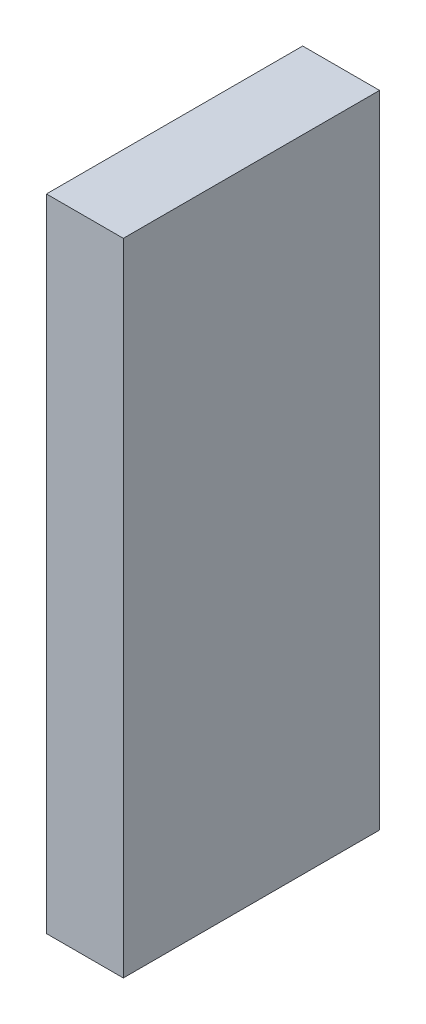
from build123d import *

# Parameters (mm, degrees)
SKETCH1_W           = 12
SKETCH1_H           = 40
BOSS_EXTRUDE1_DEPTH = 50
F_25_SCALE_SCALE    = 0.25


with BuildPart() as part:
    # Sketch1 → Boss-Extrude1 (new, symmetric)
    with BuildSketch(Plane(origin=(0, 0, 0), x_dir=(1, 0, 0), z_dir=(0, 1, 0))):
        Rectangle(SKETCH1_W, SKETCH1_H)
    extrude(amount=BOSS_EXTRUDE1_DEPTH, both=True)


with BuildPart() as part_1:
    # 25% Scale: scaled about (0, 0, 0)
    add(part.part.scale(F_25_SCALE_SCALE))


solid = part_1.part
